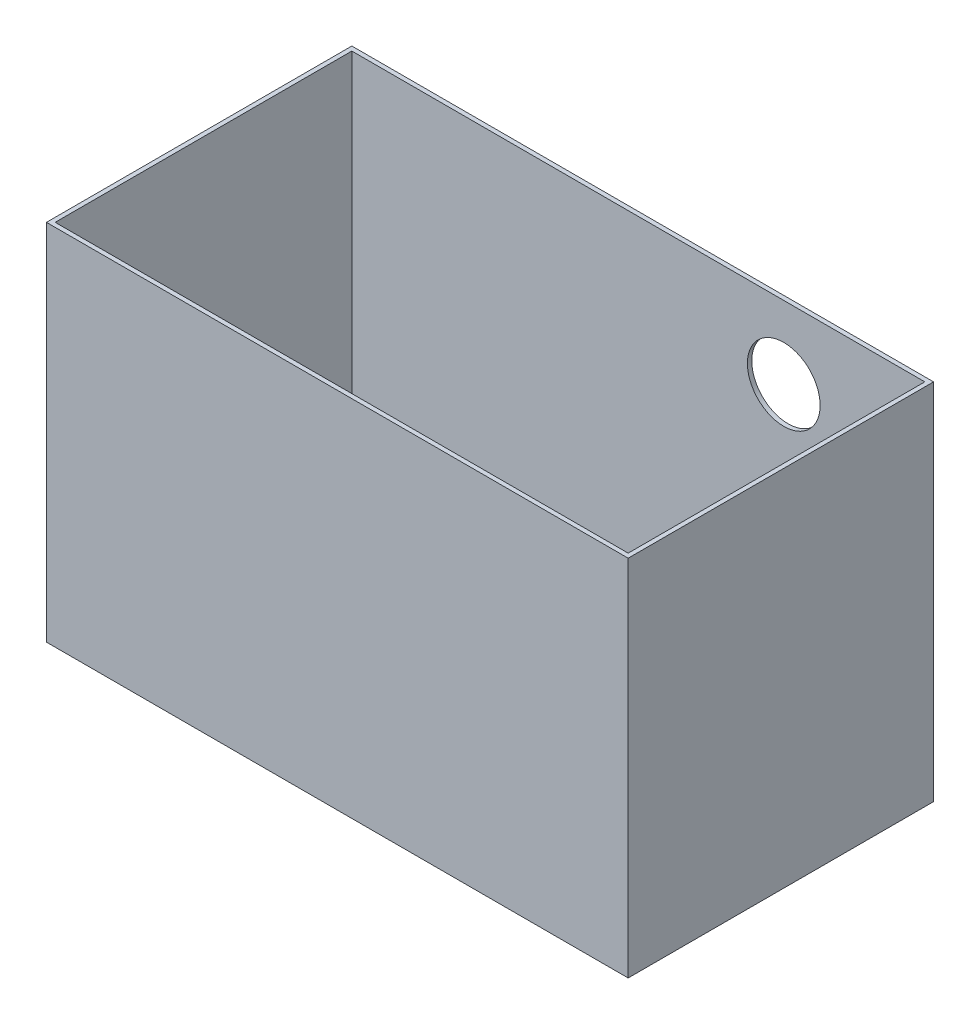
from build123d import *

# Parameters (mm, degrees)
SKETCH1_W           = 400
SKETCH1_H           = 210
SKETCH1_W_2         = 394
SKETCH1_H_2         = 204
EXTRUDE_THIN1_DEPTH = 250
SKETCH4_R           = 25
CUT_EXTRUDE1_DEPTH  = 10


with BuildPart() as part:
    # Sketch1 → Extrude-Thin1 (new body)
    with BuildSketch(Plane(origin=(0, 0, 0), x_dir=(1, 0, 0), z_dir=(0, 1, 0))):
        with Locations((200, -105)):
            Rectangle(SKETCH1_W, SKETCH1_H)
        with Locations((200, -105)):
            Rectangle(SKETCH1_W_2, SKETCH1_H_2, mode=Mode.SUBTRACT)
    extrude(amount=EXTRUDE_THIN1_DEPTH)

    # Sketch4 → Cut-Extrude1 (cut)
    with BuildSketch(Plane(origin=(0, 0, 0), x_dir=(-1, 0, 0), z_dir=(0, 0, -1))):
        with Locations((-300, 200)):
            Circle(SKETCH4_R)
    extrude(amount=-CUT_EXTRUDE1_DEPTH, mode=Mode.SUBTRACT)


solid = part.part
